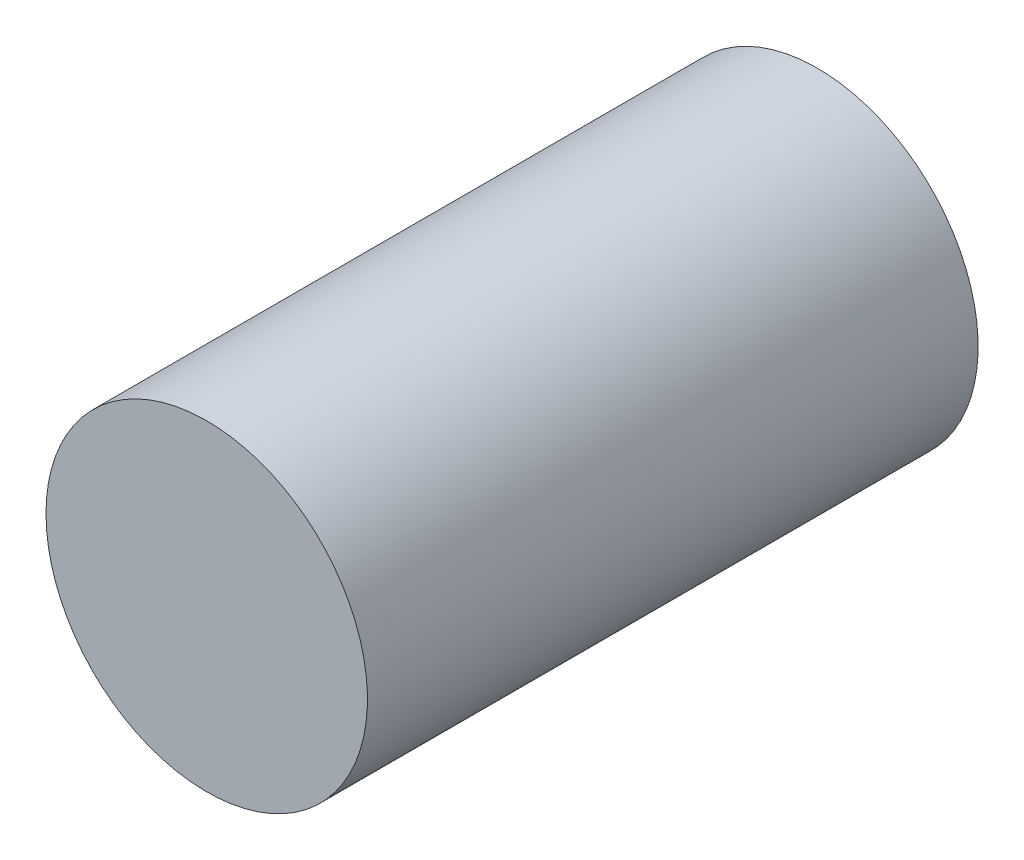
from build123d import *

# Parameters (mm, degrees)
SKETCH_1_R      = 1
EXTRUDE_2_DEPTH = 3.8


with BuildPart() as part:
    # 草图1 → 凸台-拉伸2 (new body)
    with BuildSketch(Plane.XY):
        with Locations(Location((0, 0, 0), (0, 0, 180))):
            Circle(SKETCH_1_R)
    extrude(amount=EXTRUDE_2_DEPTH)


solid = part.part
